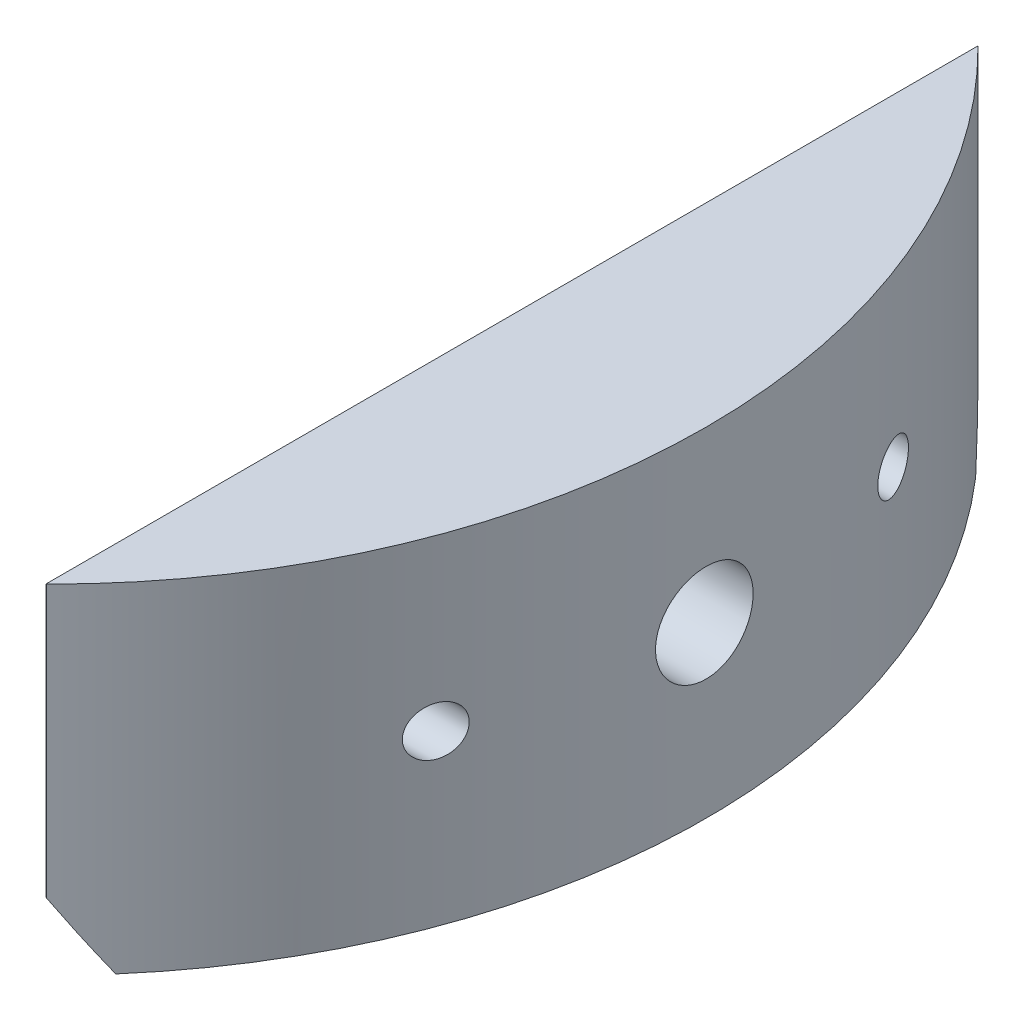
from build123d import *

# Parameters (mm, degrees)
BOSS_EXTRUDE1_DEPTH     = 25.4
CUT_EXTRUDE2_REACH      = 47.575
CUT_EXTRUDE2_END_RADIUS = 49.2125
SKETCH4_R               = 1.27
CUT_EXTRUDE4_START      = -14.566377
SKETCH11_R              = 3.6576
CUT_EXTRUDE4_DEPTH      = 7.62
CUT_EXTRUDE5_REACH      = 67.474
CUT_EXTRUDE5_END_RADIUS = 49.2125
SKETCH15_R              = 1.8288
CHAMFER1_SIZE           = 2.54
CHAMFER1_SIZE2          = 5.08


with BuildPart() as part:
    # Sketch2 → Boss-Extrude1 (new body)
    with BuildSketch(Plane(origin=(0, 0, 0), x_dir=(1, 0, 0), z_dir=(0, 1, 0))):
        with BuildLine():
            Line((34.671523348, 34.925), (34.646123348, 34.925))
            Line((34.646123348, 34.925), (34.646123348, -34.925))
            Line((34.646123348, -34.925), (34.671523348, -34.925))
            ThreePointArc((34.671523348, -34.925), (49.2125, 0), (34.671523348, 34.925))
        make_face()
    extrude(amount=BOSS_EXTRUDE1_DEPTH)

    # Cut-Extrude2: up to this cylinder (the profile starts inside it)
    cut_extrude2_end = Plane(origin=(0, 12.7, 0), z_dir=(0, -1, 0)) * Cylinder(CUT_EXTRUDE2_END_RADIUS, 194.575, mode=Mode.PRIVATE)
    # Sketch4 → Cut-Extrude2 (cut, up to the surface)
    with BuildSketch(Plane.ZY.offset(-34.646123348), mode=Mode.PRIVATE) as cut_extrude2_sk1:
        with Locations((0, 12.7)):
            Circle(SKETCH4_R)
    cut_extrude2_tool1 = extrude(cut_extrude2_sk1.sketch, amount=-CUT_EXTRUDE2_REACH, mode=Mode.PRIVATE) & cut_extrude2_end
    add(cut_extrude2_tool1.solids().sort_by_distance((34.646123, 12.7, 0))[0], mode=Mode.SUBTRACT)

    # Sketch11 → Cut-Extrude4 (cut)
    with BuildSketch(Plane.ZY.offset(-34.646123348).offset(CUT_EXTRUDE4_START)):
        with Locations(Location((0, 12.7, 0), (0, 0, 180))):
            Circle(SKETCH11_R)
    extrude(amount=CUT_EXTRUDE4_DEPTH, mode=Mode.SUBTRACT)

    # Cut-Extrude5: up to this cylinder (the profile starts inside it)
    cut_extrude5_end = Plane(origin=(0, 12.7, 0), z_dir=(0, -1, 0)) * Cylinder(CUT_EXTRUDE5_END_RADIUS, 235.925334, mode=Mode.PRIVATE)
    # Sketch15 → Cut-Extrude5 (cut, up to the surface)
    with BuildSketch(Plane(origin=(0, 0, 0), x_dir=(0, 0, -1), z_dir=(1, 0, 0)), mode=Mode.PRIVATE) as cut_extrude5_sk1:
        with BuildLine():
            ThreePointArc((-18.9738, 12.7), (-17.145, 10.8712), (-15.3162, 12.7))
            Line((-15.3162, 12.7), (-18.9738, 12.7))
        make_face()
    cut_extrude5_tool1 = extrude(cut_extrude5_sk1.sketch, amount=CUT_EXTRUDE5_REACH, mode=Mode.PRIVATE) & cut_extrude5_end
    add(cut_extrude5_tool1.solids().sort_by_distance((0, 11.923833, 17.145))[0], mode=Mode.SUBTRACT)
    # Sketch15 → Cut-Extrude5 (cut, up to the surface)
    with BuildSketch(Plane(origin=(0, 0, 0), x_dir=(0, 0, -1), z_dir=(1, 0, 0)), mode=Mode.PRIVATE) as cut_extrude5_sk2:
        with BuildLine():
            Line((-18.9738, 12.7), (-15.3162, 12.7))
            ThreePointArc((-15.3162, 12.7), (-17.145, 14.5288), (-18.9738, 12.7))
        make_face()
    cut_extrude5_tool2 = extrude(cut_extrude5_sk2.sketch, amount=CUT_EXTRUDE5_REACH, mode=Mode.PRIVATE) & cut_extrude5_end
    add(cut_extrude5_tool2.solids().sort_by_distance((0, 13.476167, 17.145))[0], mode=Mode.SUBTRACT)
    # Sketch15 → Cut-Extrude5 (cut, up to the surface)
    with BuildSketch(Plane(origin=(0, 0, 0), x_dir=(0, 0, -1), z_dir=(1, 0, 0)), mode=Mode.PRIVATE) as cut_extrude5_sk3:
        with Locations(Location((17.145, 12.7, 0), (0, 0, 180))):
            Circle(SKETCH15_R)
    cut_extrude5_tool3 = extrude(cut_extrude5_sk3.sketch, amount=CUT_EXTRUDE5_REACH, mode=Mode.PRIVATE) & cut_extrude5_end
    add(cut_extrude5_tool3.solids().sort_by_distance((0, 12.7, -17.145))[0], mode=Mode.SUBTRACT)

    # Chamfer1
    chamfer1_edges = [part.edges().sort_by_distance(p)[0] for p in [
        (34.646123348, 0, 0),
    ]]
    chamfer1_side = [part.faces().sort_by_distance(p)[0] for p in [
        (40.553555626, 0, 0),
    ]]
    chamfer(chamfer1_edges, length=CHAMFER1_SIZE, length2=CHAMFER1_SIZE2, reference=chamfer1_side[0])


solid = part.part
